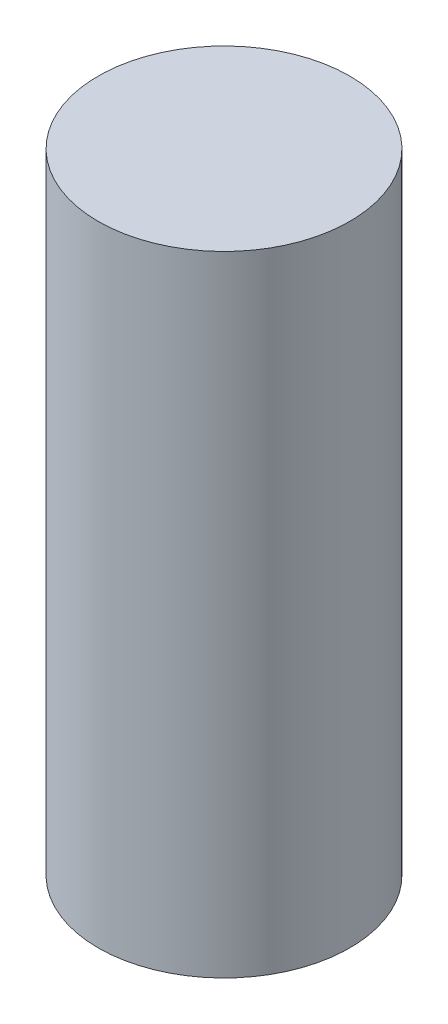
from build123d import *

# Parameters (mm, degrees)
SKETCH1_R           = 8
BOSS_EXTRUDE1_DEPTH = 40


with BuildPart() as part:
    # Sketch1 → Boss-Extrude1 (new body)
    with BuildSketch(Plane(origin=(0, 0, 0), x_dir=(1, 0, 0), z_dir=(0, 1, 0))):
        with Locations(Location((0, 0, 0), (0, 0, 270))):
            Circle(SKETCH1_R)
    extrude(amount=-BOSS_EXTRUDE1_DEPTH)


solid = part.part
